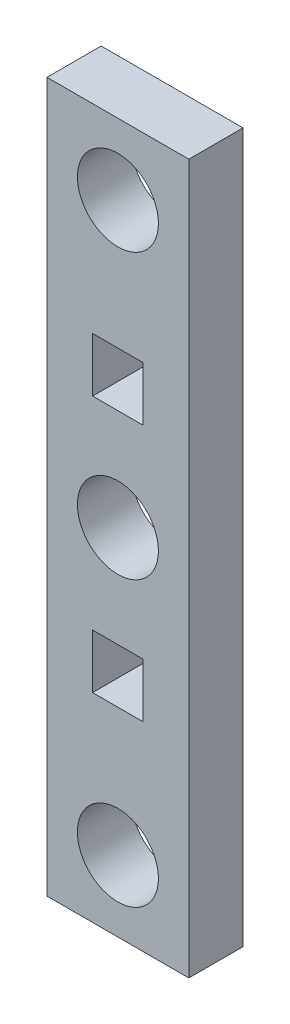
from build123d import *

# Parameters (mm, degrees)
MODEL_W             = 14.000000432
MODEL_H             = 70.000000298
MODEL_R             = 4
MODEL_W_2           = 4.999999889
MODEL_H_2           = 5.350001156
MODEL_H_3           = 5.349997431
BOSS_EXTRUDE1_DEPTH = 5.35


with BuildPart() as part:
    # Model → Boss-Extrude1 (new body)
    with BuildSketch(Plane.XY):
        with Locations((7.000000216, 35.000000149)):
            Rectangle(MODEL_W, MODEL_H)
        with Locations((7, 63)):
            Circle(MODEL_R, mode=Mode.SUBTRACT)
        with Locations((7, 35)):
            Circle(MODEL_R, mode=Mode.SUBTRACT)
        with Locations((7, 7)):
            Circle(MODEL_R, mode=Mode.SUBTRACT)
        with Locations((6.999999751, 22.324999794)):
            Rectangle(MODEL_W_2, MODEL_H_2, mode=Mode.SUBTRACT)
        with Locations((6.999999751, 47.675000504)):
            Rectangle(MODEL_W_2, MODEL_H_3, mode=Mode.SUBTRACT)
    extrude(amount=BOSS_EXTRUDE1_DEPTH)


solid = part.part
